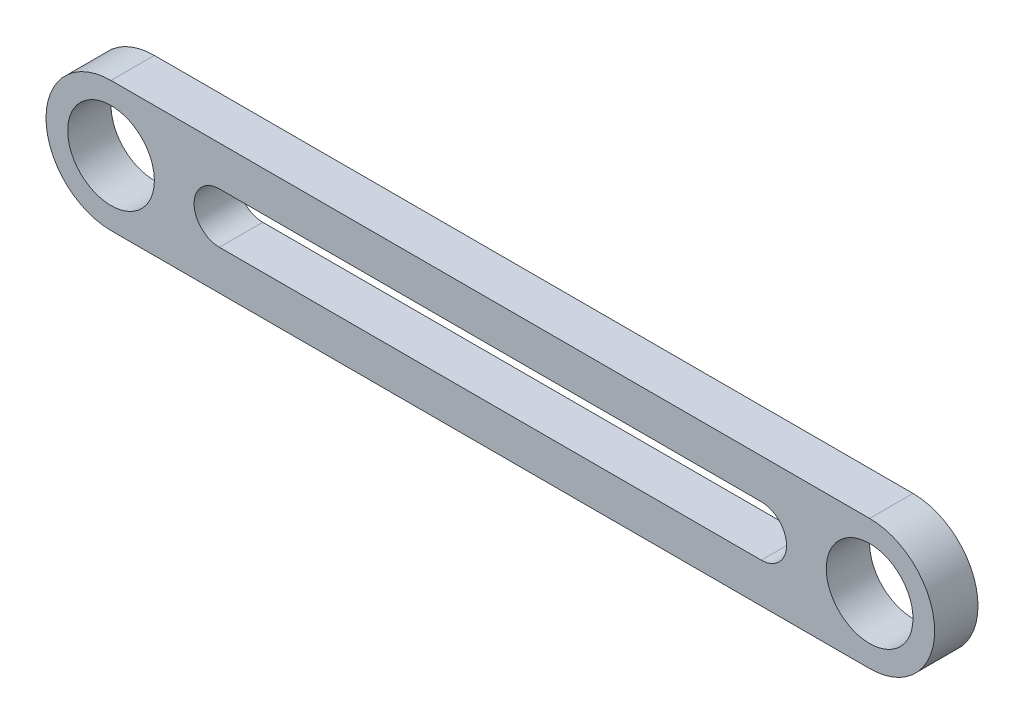
from build123d import *

# Parameters (mm, degrees)
SKETCH_1_R          = 6
EXTRUDE_1_DEPTH     = 6
CUT_EXTRUDE_1_DEPTH = 10


with BuildPart() as part:
    # 草图1 → 凸台-拉伸1 (new body)
    with BuildSketch(Plane.XY):
        with BuildLine():
            Line((0, 9), (105, 9))
            ThreePointArc((105, 9), (114, 0), (105, -9))
            Line((105, -9), (0, -9))
            ThreePointArc((0, -9), (-9, 0), (0, 9))
        make_face()
        Circle(SKETCH_1_R, mode=Mode.SUBTRACT)
        with Locations((105, 0)):
            Circle(SKETCH_1_R, mode=Mode.SUBTRACT)
    extrude(amount=EXTRUDE_1_DEPTH)

    # 草图2 → 切除-拉伸1 (cut)
    with BuildSketch(Plane.XY.offset(6)):
        with BuildLine():
            Line((15, 3.5), (90, 3.5))
            ThreePointArc((90, 3.5), (93.5, 0), (90, -3.5))
            Line((90, -3.5), (15, -3.5))
            ThreePointArc((15, -3.5), (11.5, 0), (15, 3.5))
        make_face()
    extrude(amount=-CUT_EXTRUDE_1_DEPTH, mode=Mode.SUBTRACT)


solid = part.part
